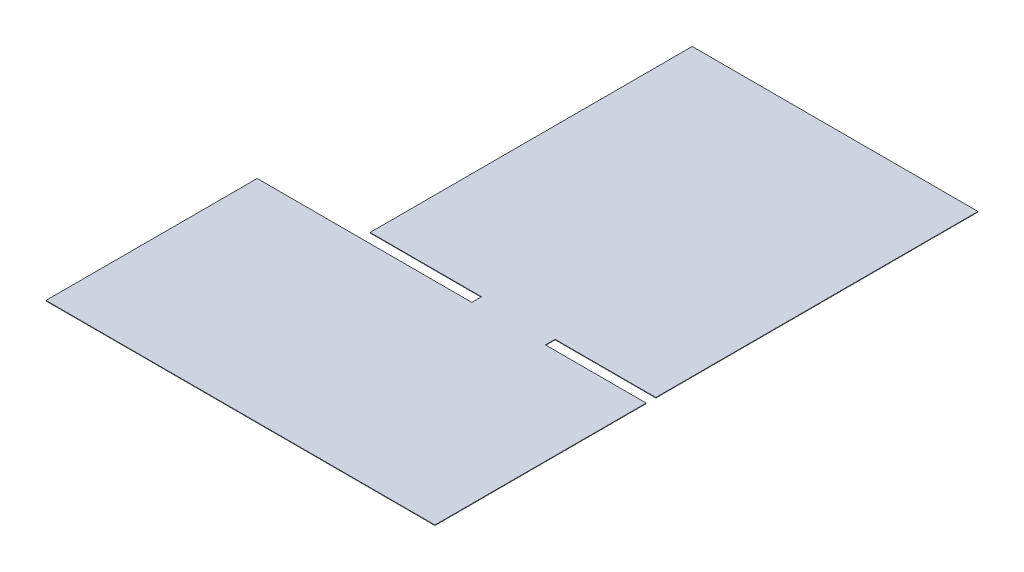
from build123d import *

# Parameters (mm, degrees)
BOSS_EXTRUDE1_DEPTH = 10


with BuildPart() as part:
    # Sketch4 → Boss-Extrude1 (new body)
    with BuildSketch(Plane(origin=(0, 0, 0), x_dir=(1, 0, 0), z_dir=(0, 1, 0))):
        Polygon((8030, 11210), (8030, 4560), (5950, 4560), (5950, 4360), (8030, 4360), (8030, 0), (0, 0), (0, 4360), (4430, 4360), (4430, 4560), (2130, 4560), (2130, 11210), align=None)
    extrude(amount=BOSS_EXTRUDE1_DEPTH)


solid = part.part
